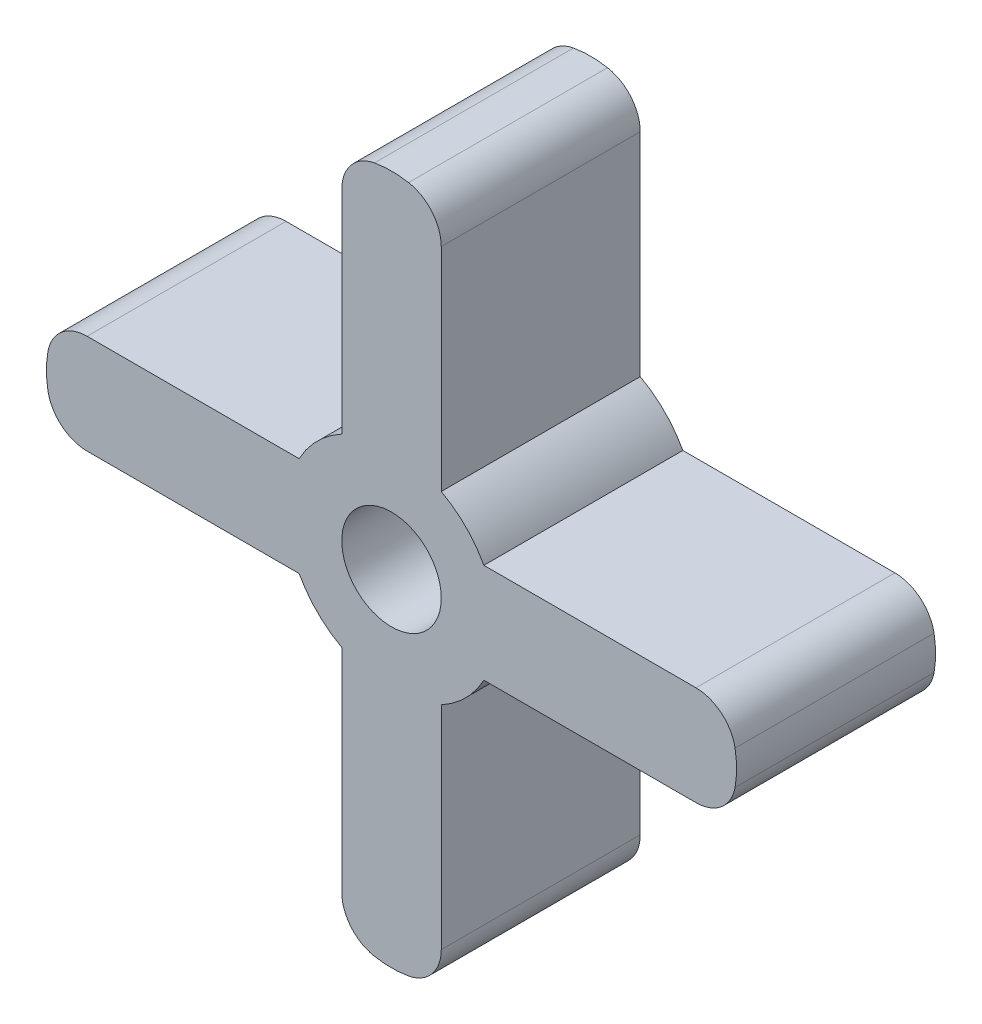
from build123d import *

# Parameters (mm, degrees)
BOSS_EXTRUDE1_DEPTH     = 10
FILLET1_R               = 2
CUT_EXTRUDE1_DEPTH      = 27.488596684
CUT_EXTRUDE1_DEPTH_BACK = 27.488596684
SKETCH4_R               = 2.5


with BuildPart() as part:
    # Sketch3 → Boss-Extrude1 (new body)
    with BuildSketch(Plane.XY):
        with BuildLine():
            Line((-2.5, 4.642135624), (-2.5, 16.642135624))
            ThreePointArc((-2.5, 16.642135624), (0, 17.344246226), (2.5, 16.642135624))
            Line((2.5, 16.642135624), (2.5, 4.642135624))
            ThreePointArc((2.5, 4.642135624), (3.728231695, 3.728231695), (4.642135624, 2.5))
            Line((4.642135624, 2.5), (16.642135624, 2.5))
            ThreePointArc((16.642135624, 2.5), (17.344246226, 0), (16.642135624, -2.5))
            Line((16.642135624, -2.5), (4.642135624, -2.5))
            ThreePointArc((4.642135624, -2.5), (3.728231695, -3.728231695), (2.5, -4.642135624))
            Line((2.5, -4.642135624), (2.5, -16.642135624))
            ThreePointArc((2.5, -16.642135624), (0, -17.344246226), (-2.5, -16.642135624))
            Line((-2.5, -16.642135624), (-2.5, -4.642135624))
            ThreePointArc((-2.5, -4.642135624), (-3.728231695, -3.728231695), (-4.642135624, -2.5))
            Line((-4.642135624, -2.5), (-16.642135624, -2.5))
            ThreePointArc((-16.642135624, -2.5), (-17.344246226, 0), (-16.642135624, 2.5))
            Line((-16.642135624, 2.5), (-4.642135624, 2.5))
            ThreePointArc((-4.642135624, 2.5), (-3.728231695, 3.728231695), (-2.5, 4.642135624))
        make_face()
    extrude(amount=BOSS_EXTRUDE1_DEPTH)

    # Fillet1
    fillet1_edges = [part.edges().sort_by_distance(p)[0] for p in [
        (-2.5, 16.642135624, 5),
        (2.5, 16.642135624, 5),
        (16.642135624, 2.5, 5),
        (16.642135624, -2.5, 5),
        (2.5, -16.642135624, 5),
        (-2.5, -16.642135624, 5),
        (-16.642135624, -2.5, 5),
        (-16.642135624, 2.5, 5),
    ]]
    fillet(fillet1_edges, radius=FILLET1_R)

    # Sketch4 → Cut-Extrude1 (cut, two sides: drawn at the far end of the back side and taken through both)
    with BuildSketch(Plane.XY.offset(-CUT_EXTRUDE1_DEPTH_BACK)):
        Circle(SKETCH4_R)
    extrude(amount=CUT_EXTRUDE1_DEPTH + CUT_EXTRUDE1_DEPTH_BACK, mode=Mode.SUBTRACT)


solid = part.part
